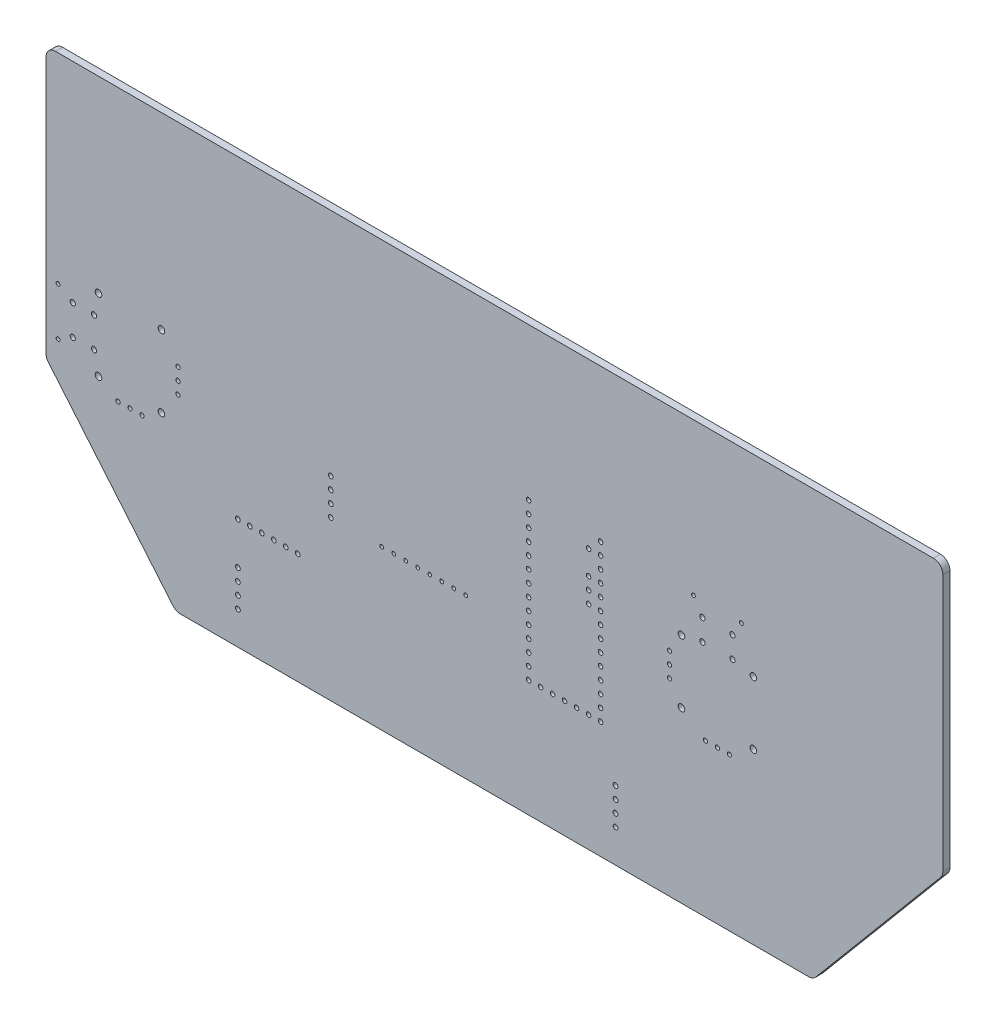
from build123d import *

# Parameters (mm, degrees)
SKETCH1_R           = 0.4
SKETCH1_R_2         = 0.4064
SKETCH1_R_3         = 0.4445
SKETCH1_R_4         = 0.4826
SKETCH1_R_5         = 0.5
SKETCH1_R_6         = 0.508
SKETCH1_R_7         = 0.55
SKETCH1_R_8         = 0.6985
BOSS_EXTRUDE1_DEPTH = 1.5


with BuildPart() as part:
    # Sketch1 → Boss-Extrude1 (new body)
    with BuildSketch(Plane.XY.offset(1.5)):
        with BuildLine():
            Line((190, 33.501164265), (190, 88))
            ThreePointArc((190, 88), (189.414213562, 89.414213562), (188, 90))
            Line((188, 90), (2, 90))
            ThreePointArc((2, 90), (0.585786438, 89.414213562), (0, 88))
            Line((0, 88), (0, 33.501164265))
            ThreePointArc((0, 33.501164265), (0.120614758, 32.817123978), (0.467911114, 32.215589046))
            Line((0.467911114, 32.215589046), (26.90052643, 0.714424781))
            ThreePointArc((26.90052643, 0.714424781), (27.587378793, 0.187384426), (28.432615316, 0))
            Line((28.432615316, 0), (161.567384684, 0))
            ThreePointArc((161.567384684, 0), (162.412621207, 0.187384426), (163.09947357, 0.714424781))
            Line((163.09947357, 0.714424781), (189.532088886, 32.215589046))
            ThreePointArc((189.532088886, 32.215589046), (189.879385242, 32.817123978), (190, 33.501164265))
        make_face()
        with Locations(Location((86.36, 33.655, 0), (0, 0, 180))):
            Circle(SKETCH1_R, mode=Mode.SUBTRACT)
        with Locations(Location((71.12, 33.655, 0), (0, 0, 180))):
            Circle(SKETCH1_R, mode=Mode.SUBTRACT)
        with Locations(Location((76.2, 33.655, 0), (0, 0, 180))):
            Circle(SKETCH1_R, mode=Mode.SUBTRACT)
        with Locations(Location((78.74, 33.655, 0), (0, 0, 180))):
            Circle(SKETCH1_R, mode=Mode.SUBTRACT)
        with Locations(Location((2.54, 47.625, 0), (0, 0, 180))):
            Circle(SKETCH1_R_2, mode=Mode.SUBTRACT)
        with Locations(Location((137.16, 57.785, 0), (0, 0, 180))):
            Circle(SKETCH1_R_2, mode=Mode.SUBTRACT)
        with Locations(Location((142.24, 32.385, 0), (0, 0, 180))):
            Circle(SKETCH1_R_3, mode=Mode.SUBTRACT)
        with Locations(Location((132.08, 42.545, 0), (0, 0, 180))):
            Circle(SKETCH1_R_3, mode=Mode.SUBTRACT)
        with Locations(Location((27.94, 45.085, 0), (0, 0, 180))):
            Circle(SKETCH1_R_3, mode=Mode.SUBTRACT)
        with Locations(Location((27.94, 40.005, 0), (0, 0, 180))):
            Circle(SKETCH1_R_3, mode=Mode.SUBTRACT)
        with Locations(Location((132.08, 40.005, 0), (0, 0, 180))):
            Circle(SKETCH1_R_3, mode=Mode.SUBTRACT)
        with Locations(Location((15.24, 32.385, 0), (0, 0, 180))):
            Circle(SKETCH1_R_3, mode=Mode.SUBTRACT)
        with Locations(Location((102.235, 57.785, 0), (0, 0, 180))):
            Circle(SKETCH1_R_4, mode=Mode.SUBTRACT)
        with Locations(Location((114.935, 47.625, 0), (0, 0, 180))):
            Circle(SKETCH1_R_4, mode=Mode.SUBTRACT)
        with Locations(Location((114.935, 55.245, 0), (0, 0, 180))):
            Circle(SKETCH1_R_4, mode=Mode.SUBTRACT)
        with Locations(Location((117.475, 55.245, 0), (0, 0, 180))):
            Circle(SKETCH1_R_4, mode=Mode.SUBTRACT)
        with Locations(Location((117.475, 50.165, 0), (0, 0, 180))):
            Circle(SKETCH1_R_4, mode=Mode.SUBTRACT)
        with Locations(Location((117.475, 45.085, 0), (0, 0, 180))):
            Circle(SKETCH1_R_4, mode=Mode.SUBTRACT)
        with Locations(Location((117.475, 40.005, 0), (0, 0, 180))):
            Circle(SKETCH1_R_4, mode=Mode.SUBTRACT)
        with Locations(Location((117.475, 34.925, 0), (0, 0, 180))):
            Circle(SKETCH1_R_4, mode=Mode.SUBTRACT)
        with Locations(Location((117.475, 29.845, 0), (0, 0, 180))):
            Circle(SKETCH1_R_4, mode=Mode.SUBTRACT)
        with Locations(Location((117.475, 24.765, 0), (0, 0, 180))):
            Circle(SKETCH1_R_4, mode=Mode.SUBTRACT)
        with Locations(Location((112.395, 24.765, 0), (0, 0, 180))):
            Circle(SKETCH1_R_4, mode=Mode.SUBTRACT)
        with Locations(Location((107.315, 24.765, 0), (0, 0, 180))):
            Circle(SKETCH1_R_4, mode=Mode.SUBTRACT)
        with Locations(Location((102.235, 24.765, 0), (0, 0, 180))):
            Circle(SKETCH1_R_4, mode=Mode.SUBTRACT)
        with Locations(Location((102.235, 29.845, 0), (0, 0, 180))):
            Circle(SKETCH1_R_4, mode=Mode.SUBTRACT)
        with Locations(Location((102.235, 34.925, 0), (0, 0, 180))):
            Circle(SKETCH1_R_4, mode=Mode.SUBTRACT)
        with Locations(Location((102.235, 40.005, 0), (0, 0, 180))):
            Circle(SKETCH1_R_4, mode=Mode.SUBTRACT)
        with Locations(Location((102.235, 45.085, 0), (0, 0, 180))):
            Circle(SKETCH1_R_4, mode=Mode.SUBTRACT)
        with Locations(Location((102.235, 50.165, 0), (0, 0, 180))):
            Circle(SKETCH1_R_4, mode=Mode.SUBTRACT)
        with Locations(Location((43.18, 23.495, 0), (0, 0, 180))):
            Circle(SKETCH1_R_5, mode=Mode.SUBTRACT)
        with Locations(Location((48.26, 23.495, 0), (0, 0, 180))):
            Circle(SKETCH1_R_5, mode=Mode.SUBTRACT)
        with Locations(Location((53.34, 23.495, 0), (0, 0, 180))):
            Circle(SKETCH1_R_5, mode=Mode.SUBTRACT)
        with Locations(Location((120.65, 9.525, 0), (0, 0, 180))):
            Circle(SKETCH1_R_6, mode=Mode.SUBTRACT)
        with Locations(Location((120.65, 6.985, 0), (0, 0, 180))):
            Circle(SKETCH1_R_6, mode=Mode.SUBTRACT)
        with Locations(Location((60.325, 36.195, 0), (0, 0, 180))):
            Circle(SKETCH1_R_6, mode=Mode.SUBTRACT)
        with Locations(Location((60.325, 41.275, 0), (0, 0, 180))):
            Circle(SKETCH1_R_6, mode=Mode.SUBTRACT)
        with Locations(Location((40.64, 12.065, 0), (0, 0, 180))):
            Circle(SKETCH1_R_6, mode=Mode.SUBTRACT)
        with Locations(Location((40.64, 6.985, 0), (0, 0, 180))):
            Circle(SKETCH1_R_6, mode=Mode.SUBTRACT)
        with Locations(Location((5.66, 45.72, 0), (0, 0, 180))):
            Circle(SKETCH1_R_7, mode=Mode.SUBTRACT)
        with Locations(Location((10.16, 39.37, 0), (0, 0, 180))):
            Circle(SKETCH1_R_7, mode=Mode.SUBTRACT)
        with Locations(Location((145.415, 54.665, 0), (0, 0, 180))):
            Circle(SKETCH1_R_7, mode=Mode.SUBTRACT)
        with Locations(Location((139.065, 50.165, 0), (0, 0, 180))):
            Circle(SKETCH1_R_7, mode=Mode.SUBTRACT)
        with Locations(Location((11.1125, 50.165, 0), (0, 0, 180))):
            Circle(SKETCH1_R_8, mode=Mode.SUBTRACT)
        with Locations(Location((24.4475, 34.925, 0), (0, 0, 180))):
            Circle(SKETCH1_R_8, mode=Mode.SUBTRACT)
        with Locations(Location((134.62, 35.8775, 0), (0, 0, 180))):
            Circle(SKETCH1_R_8, mode=Mode.SUBTRACT)
        with Locations(Location((149.86, 49.2125, 0), (0, 0, 180))):
            Circle(SKETCH1_R_8, mode=Mode.SUBTRACT)
        with Locations(Location((134.62, 49.2125, 0), (0, 0, 180))):
            Circle(SKETCH1_R_8, mode=Mode.SUBTRACT)
        with Locations(Location((149.86, 35.8775, 0), (0, 0, 180))):
            Circle(SKETCH1_R_8, mode=Mode.SUBTRACT)
        with Locations(Location((24.4475, 50.165, 0), (0, 0, 180))):
            Circle(SKETCH1_R_8, mode=Mode.SUBTRACT)
        with Locations(Location((11.1125, 34.925, 0), (0, 0, 180))):
            Circle(SKETCH1_R_8, mode=Mode.SUBTRACT)
        with Locations(Location((145.415, 50.165, 0), (0, 0, 180))):
            Circle(SKETCH1_R_7, mode=Mode.SUBTRACT)
        with Locations(Location((139.065, 54.665, 0), (0, 0, 180))):
            Circle(SKETCH1_R_7, mode=Mode.SUBTRACT)
        with Locations(Location((10.16, 45.72, 0), (0, 0, 180))):
            Circle(SKETCH1_R_7, mode=Mode.SUBTRACT)
        with Locations(Location((5.66, 39.37, 0), (0, 0, 180))):
            Circle(SKETCH1_R_7, mode=Mode.SUBTRACT)
        with Locations(Location((120.65, 14.605, 0), (0, 0, 180))):
            Circle(SKETCH1_R_6, mode=Mode.SUBTRACT)
        with Locations(Location((40.64, 9.525, 0), (0, 0, 180))):
            Circle(SKETCH1_R_6, mode=Mode.SUBTRACT)
        with Locations(Location((40.64, 14.605, 0), (0, 0, 180))):
            Circle(SKETCH1_R_6, mode=Mode.SUBTRACT)
        with Locations(Location((60.325, 38.735, 0), (0, 0, 180))):
            Circle(SKETCH1_R_6, mode=Mode.SUBTRACT)
        with Locations(Location((60.325, 33.655, 0), (0, 0, 180))):
            Circle(SKETCH1_R_6, mode=Mode.SUBTRACT)
        with Locations(Location((120.65, 12.065, 0), (0, 0, 180))):
            Circle(SKETCH1_R_6, mode=Mode.SUBTRACT)
        with Locations(Location((40.64, 23.495, 0), (0, 0, 180))):
            Circle(SKETCH1_R_5, mode=Mode.SUBTRACT)
        with Locations(Location((50.8, 23.495, 0), (0, 0, 180))):
            Circle(SKETCH1_R_5, mode=Mode.SUBTRACT)
        with Locations(Location((45.72, 23.495, 0), (0, 0, 180))):
            Circle(SKETCH1_R_5, mode=Mode.SUBTRACT)
        with Locations(Location((102.235, 52.705, 0), (0, 0, 180))):
            Circle(SKETCH1_R_4, mode=Mode.SUBTRACT)
        with Locations(Location((102.235, 47.625, 0), (0, 0, 180))):
            Circle(SKETCH1_R_4, mode=Mode.SUBTRACT)
        with Locations(Location((102.235, 42.545, 0), (0, 0, 180))):
            Circle(SKETCH1_R_4, mode=Mode.SUBTRACT)
        with Locations(Location((102.235, 37.465, 0), (0, 0, 180))):
            Circle(SKETCH1_R_4, mode=Mode.SUBTRACT)
        with Locations(Location((102.235, 32.385, 0), (0, 0, 180))):
            Circle(SKETCH1_R_4, mode=Mode.SUBTRACT)
        with Locations(Location((102.235, 27.305, 0), (0, 0, 180))):
            Circle(SKETCH1_R_4, mode=Mode.SUBTRACT)
        with Locations(Location((104.775, 24.765, 0), (0, 0, 180))):
            Circle(SKETCH1_R_4, mode=Mode.SUBTRACT)
        with Locations(Location((109.855, 24.765, 0), (0, 0, 180))):
            Circle(SKETCH1_R_4, mode=Mode.SUBTRACT)
        with Locations(Location((114.935, 24.765, 0), (0, 0, 180))):
            Circle(SKETCH1_R_4, mode=Mode.SUBTRACT)
        with Locations(Location((117.475, 27.305, 0), (0, 0, 180))):
            Circle(SKETCH1_R_4, mode=Mode.SUBTRACT)
        with Locations(Location((117.475, 32.385, 0), (0, 0, 180))):
            Circle(SKETCH1_R_4, mode=Mode.SUBTRACT)
        with Locations(Location((117.475, 37.465, 0), (0, 0, 180))):
            Circle(SKETCH1_R_4, mode=Mode.SUBTRACT)
        with Locations(Location((117.475, 42.545, 0), (0, 0, 180))):
            Circle(SKETCH1_R_4, mode=Mode.SUBTRACT)
        with Locations(Location((117.475, 47.625, 0), (0, 0, 180))):
            Circle(SKETCH1_R_4, mode=Mode.SUBTRACT)
        with Locations(Location((117.475, 52.705, 0), (0, 0, 180))):
            Circle(SKETCH1_R_4, mode=Mode.SUBTRACT)
        with Locations(Location((117.475, 57.785, 0), (0, 0, 180))):
            Circle(SKETCH1_R_4, mode=Mode.SUBTRACT)
        with Locations(Location((114.935, 50.165, 0), (0, 0, 180))):
            Circle(SKETCH1_R_4, mode=Mode.SUBTRACT)
        with Locations(Location((114.935, 45.085, 0), (0, 0, 180))):
            Circle(SKETCH1_R_4, mode=Mode.SUBTRACT)
        with Locations(Location((102.235, 55.245, 0), (0, 0, 180))):
            Circle(SKETCH1_R_4, mode=Mode.SUBTRACT)
        with Locations(Location((20.32, 32.385, 0), (0, 0, 180))):
            Circle(SKETCH1_R_3, mode=Mode.SUBTRACT)
        with Locations(Location((17.78, 32.385, 0), (0, 0, 180))):
            Circle(SKETCH1_R_3, mode=Mode.SUBTRACT)
        with Locations(Location((27.94, 42.545, 0), (0, 0, 180))):
            Circle(SKETCH1_R_3, mode=Mode.SUBTRACT)
        with Locations(Location((132.08, 45.085, 0), (0, 0, 180))):
            Circle(SKETCH1_R_3, mode=Mode.SUBTRACT)
        with Locations(Location((139.7, 32.385, 0), (0, 0, 180))):
            Circle(SKETCH1_R_3, mode=Mode.SUBTRACT)
        with Locations(Location((144.78, 32.385, 0), (0, 0, 180))):
            Circle(SKETCH1_R_3, mode=Mode.SUBTRACT)
        with Locations(Location((147.32, 57.785, 0), (0, 0, 180))):
            Circle(SKETCH1_R_2, mode=Mode.SUBTRACT)
        with Locations(Location((2.54, 37.465, 0), (0, 0, 180))):
            Circle(SKETCH1_R_2, mode=Mode.SUBTRACT)
        with Locations(Location((81.28, 33.655, 0), (0, 0, 180))):
            Circle(SKETCH1_R, mode=Mode.SUBTRACT)
        with Locations(Location((73.66, 33.655, 0), (0, 0, 180))):
            Circle(SKETCH1_R, mode=Mode.SUBTRACT)
        with Locations(Location((83.82, 33.655, 0), (0, 0, 180))):
            Circle(SKETCH1_R, mode=Mode.SUBTRACT)
        with Locations(Location((88.9, 33.655, 0), (0, 0, 180))):
            Circle(SKETCH1_R, mode=Mode.SUBTRACT)
    extrude(amount=-BOSS_EXTRUDE1_DEPTH)


solid = part.part
